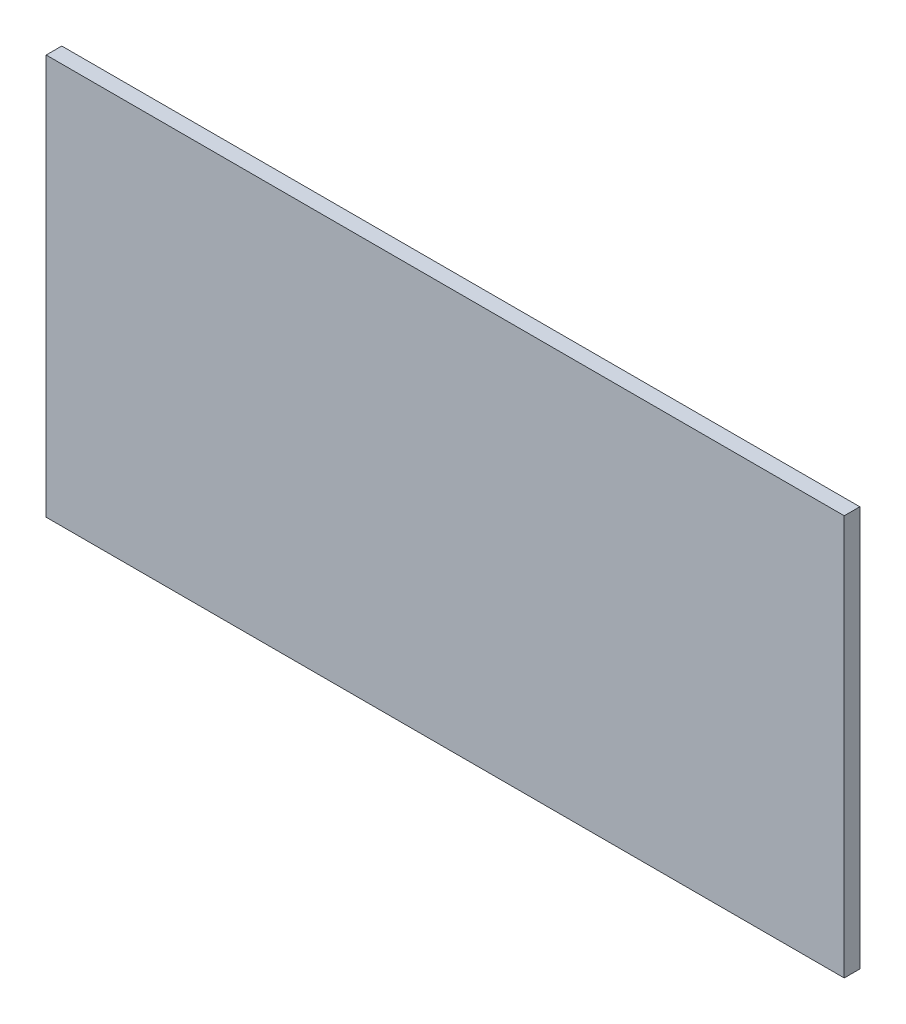
from build123d import *

# Parameters (mm, degrees)
SKETCH_1_W      = 307
SKETCH_1_H      = 154
EXTRUDE_1_DEPTH = 6


with BuildPart() as part:
    # Эскиз1 → Бобышка-Вытянуть1 (new body)
    with BuildSketch(Plane.XY):
        Rectangle(SKETCH_1_W, SKETCH_1_H)
    extrude(amount=EXTRUDE_1_DEPTH)


solid = part.part
